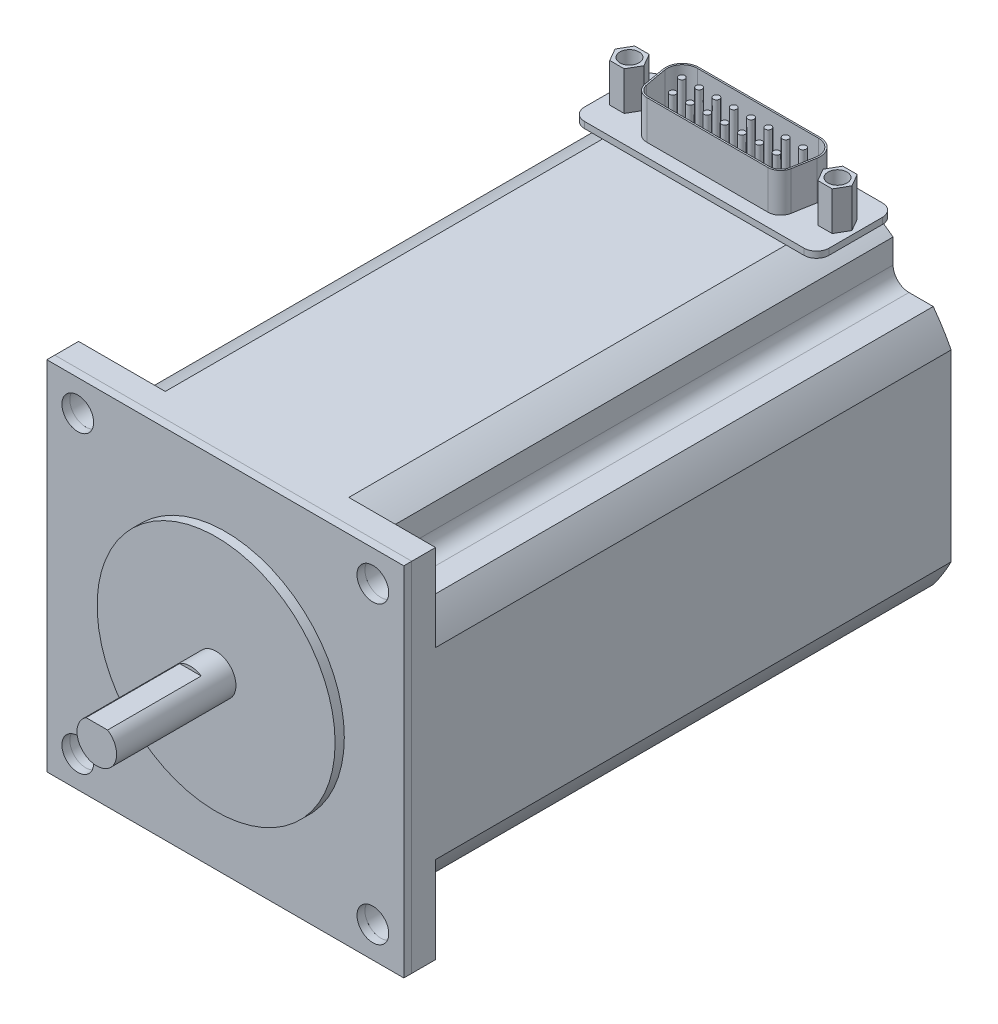
from build123d import *

# Parameters (mm, degrees)
SKETCH2_W            = 57.15
SKETCH2_H            = 57.15
SKETCH2_R            = 2.54
BODY_FRONT_DEPTH     = 3.81
SKETCH3_W            = 57.15
SKETCH3_H            = 57.15
SKETCH3_R            = 2.54
FACE_PLATE_DEPTH     = 1.27
BODY_REAR_DEPTH      = 82.55
SKETCH5_R            = 19.05
SHAFT_BASE_DEPTH     = 1.4732
SKETCH6_R            = 3.175
SHAFT_DEPTH          = 19.1008
SHAFT_FLAT_DEPTH     = 14.986
SKETCH9_R            = 1.525
CONNECTOR_BASE_DEPTH = 1
SKETCH10_R           = 1.525
SKETCH10_R_2         = 0.5
CONNECTOR_DEPTH      = 6.2
SCALE1_SCALE         = 2
SCALE2_SCALE         = 0.1
SCALE3_SCALE         = 3


with BuildPart() as part:
    # Sketch2 → Body Front (new body)
    with BuildSketch(Plane.XY):
        Rectangle(SKETCH2_W, SKETCH2_H)
        with Locations(Location((-23.622, -23.622, 0), (0, 0, 180))):
            Circle(SKETCH2_R, mode=Mode.SUBTRACT)
        with Locations(Location((-23.622, 23.622, 0), (0, 0, 180))):
            Circle(SKETCH2_R, mode=Mode.SUBTRACT)
        with Locations(Location((23.622, 23.622, 0), (0, 0, 180))):
            Circle(SKETCH2_R, mode=Mode.SUBTRACT)
        with Locations(Location((23.622, -23.622, 0), (0, 0, 180))):
            Circle(SKETCH2_R, mode=Mode.SUBTRACT)
    extrude(amount=BODY_FRONT_DEPTH)

    # Sketch4 → Body Rear (add)
    with BuildSketch(Plane(origin=(0, 0, 0), x_dir=(-1, 0, 0), z_dir=(0, 0, -1))):
        with BuildLine():
            Line((-21.8186, -19.2786), (-25.7048, -19.2786))
            ThreePointArc((-25.7048, -19.2786), (-27.236596224, -17.046084217), (-28.575, -14.692533342))
            Line((-28.575, -14.692533342), (-28.575, 14.692533342))
            ThreePointArc((-28.575, 14.692533342), (-27.236596224, 17.046084217), (-25.7048, 19.2786))
            Line((-25.7048, 19.2786), (-21.8186, 19.2786))
            ThreePointArc((-21.8186, 19.2786), (-20.022548776, 20.022548776), (-19.2786, 21.8186))
            Line((-19.2786, 21.8186), (-19.2786, 25.7048))
            ThreePointArc((-19.2786, 25.7048), (-17.046084217, 27.236596224), (-14.692533342, 28.575))
            Line((-14.692533342, 28.575), (14.692533342, 28.575))
            ThreePointArc((14.692533342, 28.575), (17.046084217, 27.236596224), (19.2786, 25.7048))
            Line((19.2786, 25.7048), (19.2786, 21.8186))
            ThreePointArc((19.2786, 21.8186), (20.022548776, 20.022548776), (21.8186, 19.2786))
            Line((21.8186, 19.2786), (25.7048, 19.2786))
            ThreePointArc((25.7048, 19.2786), (27.236596224, 17.046084217), (28.575, 14.692533342))
            Line((28.575, 14.692533342), (28.575, -14.692533342))
            ThreePointArc((28.575, -14.692533342), (27.236596224, -17.046084217), (25.7048, -19.2786))
            Line((25.7048, -19.2786), (21.8186, -19.2786))
            ThreePointArc((21.8186, -19.2786), (20.022548776, -20.022548776), (19.2786, -21.8186))
            Line((19.2786, -21.8186), (19.2786, -25.7048))
            ThreePointArc((19.2786, -25.7048), (17.046084217, -27.236596224), (14.692533342, -28.575))
            Line((14.692533342, -28.575), (-14.692533342, -28.575))
            ThreePointArc((-14.692533342, -28.575), (-17.046084217, -27.236596224), (-19.2786, -25.7048))
            Line((-19.2786, -25.7048), (-19.2786, -21.8186))
            ThreePointArc((-19.2786, -21.8186), (-20.022548776, -20.022548776), (-21.8186, -19.2786))
        make_face()
    extrude(amount=BODY_REAR_DEPTH)


with BuildPart() as body_2:
    # Sketch3 → Face Plate (new body)
    with BuildSketch(Plane.XY.offset(3.81)):
        Rectangle(SKETCH3_W, SKETCH3_H)
        with Locations(Location((-23.622, 23.622, 0), (0, 0, 180))):
            Circle(SKETCH3_R, mode=Mode.SUBTRACT)
        with Locations(Location((-23.622, -23.622, 0), (0, 0, 180))):
            Circle(SKETCH3_R, mode=Mode.SUBTRACT)
        with Locations(Location((23.622, -23.622, 0), (0, 0, 180))):
            Circle(SKETCH3_R, mode=Mode.SUBTRACT)
        with Locations(Location((23.622, 23.622, 0), (0, 0, 180))):
            Circle(SKETCH3_R, mode=Mode.SUBTRACT)
    extrude(amount=FACE_PLATE_DEPTH)


with BuildPart() as body_3:
    # Sketch5 → Shaft Base (new body)
    with BuildSketch(Plane.XY.offset(5.08)):
        Circle(SKETCH5_R)
    extrude(amount=SHAFT_BASE_DEPTH)


with BuildPart() as body_4:
    # Sketch6 → Shaft (new body)
    with BuildSketch(Plane.XY.offset(6.5532)):
        Circle(SKETCH6_R)
    extrude(amount=SHAFT_DEPTH)

    # Sketch7 → Shaft Flat (cut)
    with BuildSketch(Plane.XY.offset(25.654)):
        with BuildLine():
            Line((-1.722711816, 2.667), (1.722711816, 2.667))
            ThreePointArc((1.722711816, 2.667), (0, 3.175), (-1.722711816, 2.667))
        make_face()
    extrude(amount=-SHAFT_FLAT_DEPTH, mode=Mode.SUBTRACT)


with BuildPart() as body_5:
    # Sketch9 → Connector Base (new body)
    with BuildSketch(Plane(origin=(0, 28.575, 0), x_dir=(1, 0, 0), z_dir=(0, 1, 0))):
        with BuildLine():
            Line((-19.57, 72), (-19.57, 80.55))
            ThreePointArc((-19.57, 80.55), (-18.984213562, 81.964213562), (-17.57, 82.55))
            Line((-17.57, 82.55), (17.57, 82.55))
            ThreePointArc((17.57, 82.55), (18.984213562, 81.964213562), (19.57, 80.55))
            Line((19.57, 80.55), (19.57, 72))
            ThreePointArc((19.57, 72), (18.984213562, 70.585786438), (17.57, 70))
            Line((17.57, 70), (-17.57, 70))
            ThreePointArc((-17.57, 70), (-18.984213562, 70.585786438), (-19.57, 72))
        make_face()
        with Locations(Location((16.655, 76.275, 0), (0, 0, 270))):
            Circle(SKETCH9_R, mode=Mode.SUBTRACT)
        with Locations(Location((-16.655, 76.275, 0), (0, 0, 270))):
            Circle(SKETCH9_R, mode=Mode.SUBTRACT)
    extrude(amount=CONNECTOR_BASE_DEPTH)

    # Sketch10 → Connector (add)
    # profile 1 of 18: a face of its own
    with BuildSketch(Plane(origin=(0, 29.575, 0), x_dir=(1, 0, 0), z_dir=(0, 1, 0))):
        Polygon((-14.345598923, 76.275), (-15.500299462, 78.275), (-17.809700538, 78.275), (-18.964401077, 76.275), (-17.809700538, 74.275), (-15.500299462, 74.275), align=None)
        with Locations(Location((-16.655, 76.275, 0), (0, 0, 90))):
            Circle(SKETCH10_R, mode=Mode.SUBTRACT)
    # profile 2 of 18: a face of its own
    with BuildSketch(Plane(origin=(0, 29.575, 0), x_dir=(1, 0, 0), z_dir=(0, 1, 0))):
        with BuildLine():
            Line((-11.707361689, 73.783571951), (-12.33, 77.314729284))
            ThreePointArc((-12.33, 77.314729284), (-11.744666142, 79.499224981), (-9.695, 80.455))
            Line((-9.695, 80.455), (9.695, 80.455))
            ThreePointArc((9.695, 80.455), (11.744666142, 79.499224981), (12.33, 77.314729284))
            Line((12.33, 77.314729284), (11.707361689, 73.783571951))
            ThreePointArc((11.707361689, 73.783571951), (11.008475809, 72.573066098), (9.695, 72.095))
            Line((9.695, 72.095), (-9.695, 72.095))
            ThreePointArc((-9.695, 72.095), (-11.008475809, 72.573066098), (-11.707361689, 73.783571951))
        make_face()
        with BuildLine():
            ThreePointArc((-9.695, 80.205), (-11.553155031, 79.338528079), (-12.083798062, 77.358141328))
            Line((-12.083798062, 77.358141328), (-11.461159751, 73.826983996))
            ThreePointArc((-11.461159751, 73.826983996), (-10.847778906, 72.764577209), (-9.695, 72.345))
            Line((-9.695, 72.345), (9.695, 72.345))
            ThreePointArc((9.695, 72.345), (10.847778906, 72.764577209), (11.461159751, 73.826983996))
            Line((11.461159751, 73.826983996), (12.083798062, 77.358141328))
            ThreePointArc((12.083798062, 77.358141328), (11.553155031, 79.338528079), (9.695, 80.205))
            Line((9.695, 80.205), (-9.695, 80.205))
        make_face(mode=Mode.SUBTRACT)
    # profile 3 of 18: a face of its own
    with BuildSketch(Plane(origin=(0, 29.575, 0), x_dir=(1, 0, 0), z_dir=(0, 1, 0))):
        with Locations(Location((-9.695, 77.695, 0), (0, 0, 90))):
            Circle(SKETCH10_R_2)
    # profile 4 of 18: a face of its own
    with BuildSketch(Plane(origin=(0, 29.575, 0), x_dir=(1, 0, 0), z_dir=(0, 1, 0))):
        with Locations(Location((-6.92386, 77.695, 0), (0, 0, 90))):
            Circle(SKETCH10_R_2)
    # profile 5 of 18: a face of its own
    with BuildSketch(Plane(origin=(0, 29.575, 0), x_dir=(1, 0, 0), z_dir=(0, 1, 0))):
        with Locations(Location((-8.31, 74.855, 0), (0, 0, 90))):
            Circle(SKETCH10_R_2)
    # profile 6 of 18: a face of its own
    with BuildSketch(Plane(origin=(0, 29.575, 0), x_dir=(1, 0, 0), z_dir=(0, 1, 0))):
        with Locations(Location((-5.53886, 74.855, 0), (0, 0, 90))):
            Circle(SKETCH10_R_2)
    # profile 7 of 18: a face of its own
    with BuildSketch(Plane(origin=(0, 29.575, 0), x_dir=(1, 0, 0), z_dir=(0, 1, 0))):
        with Locations(Location((-2.76772, 74.855, 0), (0, 0, 90))):
            Circle(SKETCH10_R_2)
    # profile 8 of 18: a face of its own
    with BuildSketch(Plane(origin=(0, 29.575, 0), x_dir=(1, 0, 0), z_dir=(0, 1, 0))):
        with Locations(Location((-4.15272, 77.695, 0), (0, 0, 90))):
            Circle(SKETCH10_R_2)
    # profile 9 of 18: a face of its own
    with BuildSketch(Plane(origin=(0, 29.575, 0), x_dir=(1, 0, 0), z_dir=(0, 1, 0))):
        with Locations(Location((0.00342, 74.855, 0), (0, 0, 90))):
            Circle(SKETCH10_R_2)
    # profile 10 of 18: a face of its own
    with BuildSketch(Plane(origin=(0, 29.575, 0), x_dir=(1, 0, 0), z_dir=(0, 1, 0))):
        with Locations(Location((1.38956, 77.695, 0), (0, 0, 90))):
            Circle(SKETCH10_R_2)
    # profile 11 of 18: a face of its own
    with BuildSketch(Plane(origin=(0, 29.575, 0), x_dir=(1, 0, 0), z_dir=(0, 1, 0))):
        with Locations(Location((2.77456, 74.855, 0), (0, 0, 90))):
            Circle(SKETCH10_R_2)
    # profile 12 of 18: a face of its own
    with BuildSketch(Plane(origin=(0, 29.575, 0), x_dir=(1, 0, 0), z_dir=(0, 1, 0))):
        with Locations(Location((4.1607, 77.695, 0), (0, 0, 90))):
            Circle(SKETCH10_R_2)
    # profile 13 of 18: a face of its own
    with BuildSketch(Plane(origin=(0, 29.575, 0), x_dir=(1, 0, 0), z_dir=(0, 1, 0))):
        with Locations(Location((5.5457, 74.855, 0), (0, 0, 90))):
            Circle(SKETCH10_R_2)
    # profile 14 of 18: a face of its own
    with BuildSketch(Plane(origin=(0, 29.575, 0), x_dir=(1, 0, 0), z_dir=(0, 1, 0))):
        with Locations(Location((6.93184, 77.695, 0), (0, 0, 90))):
            Circle(SKETCH10_R_2)
    # profile 15 of 18: a face of its own
    with BuildSketch(Plane(origin=(0, 29.575, 0), x_dir=(1, 0, 0), z_dir=(0, 1, 0))):
        with Locations(Location((8.31684, 74.855, 0), (0, 0, 90))):
            Circle(SKETCH10_R_2)
    # profile 16 of 18: a face of its own
    with BuildSketch(Plane(origin=(0, 29.575, 0), x_dir=(1, 0, 0), z_dir=(0, 1, 0))):
        with Locations(Location((9.70298, 77.695, 0), (0, 0, 90))):
            Circle(SKETCH10_R_2)
    # profile 17 of 18: a face of its own
    with BuildSketch(Plane(origin=(0, 29.575, 0), x_dir=(1, 0, 0), z_dir=(0, 1, 0))):
        Polygon((17.809700538, 78.275), (15.500299462, 78.275), (14.345598923, 76.275), (15.500299462, 74.275), (17.809700538, 74.275), (18.964401077, 76.275), align=None)
        with Locations(Location((16.655, 76.275, 0), (0, 0, 90))):
            Circle(SKETCH10_R, mode=Mode.SUBTRACT)
    # profile 18 of 18: a face of its own
    with BuildSketch(Plane(origin=(0, 29.575, 0), x_dir=(1, 0, 0), z_dir=(0, 1, 0))):
        with Locations(Location((-1.38158, 77.695, 0), (0, 0, 90))):
            Circle(SKETCH10_R_2)
    extrude(amount=CONNECTOR_DEPTH)


with BuildPart() as body_5_1:
    # Scale1: scaled about (0, 0, 0)
    add(body_5.part.scale(SCALE1_SCALE))


with BuildPart() as body_3_1:
    # Scale1: scaled about (0, 0, 0)
    add(body_3.part.scale(SCALE1_SCALE))


with BuildPart() as body_4_1:
    # Scale1: scaled about (0, 0, 0)
    add(body_4.part.scale(SCALE1_SCALE))


with BuildPart() as body_2_1:
    # Scale1: scaled about (0, 0, 0)
    add(body_2.part.scale(SCALE1_SCALE))


with BuildPart() as part_1:
    # Scale1: scaled about (0, 0, 0)
    add(part.part.scale(SCALE1_SCALE))


with BuildPart() as body_3_2:
    # Scale2: scaled about (0, 0, 0)
    add(body_3_1.part.scale(SCALE2_SCALE))


with BuildPart() as part_2:
    # Scale2: scaled about (0, 0, 0)
    add(part_1.part.scale(SCALE2_SCALE))


with BuildPart() as body_4_2:
    # Scale2: scaled about (0, 0, 0)
    add(body_4_1.part.scale(SCALE2_SCALE))


with BuildPart() as body_5_2:
    # Scale2: scaled about (0, 0, 0)
    add(body_5_1.part.scale(SCALE2_SCALE))


with BuildPart() as body_2_2:
    # Scale2: scaled about (0, 0, 0)
    add(body_2_1.part.scale(SCALE2_SCALE))


with BuildPart() as body_4_3:
    # Scale3: scaled about (0, 0, 0)
    add(body_4_2.part.scale(SCALE3_SCALE))


with BuildPart() as body_2_3:
    # Scale3: scaled about (0, 0, 0)
    add(body_2_2.part.scale(SCALE3_SCALE))


with BuildPart() as body_3_3:
    # Scale3: scaled about (0, 0, 0)
    add(body_3_2.part.scale(SCALE3_SCALE))


with BuildPart() as body_5_3:
    # Scale3: scaled about (0, 0, 0)
    add(body_5_2.part.scale(SCALE3_SCALE))


with BuildPart() as part_3:
    # Scale3: scaled about (0, 0, 0)
    add(part_2.part.scale(SCALE3_SCALE))


solid = Compound([body_4_3.part, body_2_3.part, body_3_3.part, body_5_3.part, part_3.part])
